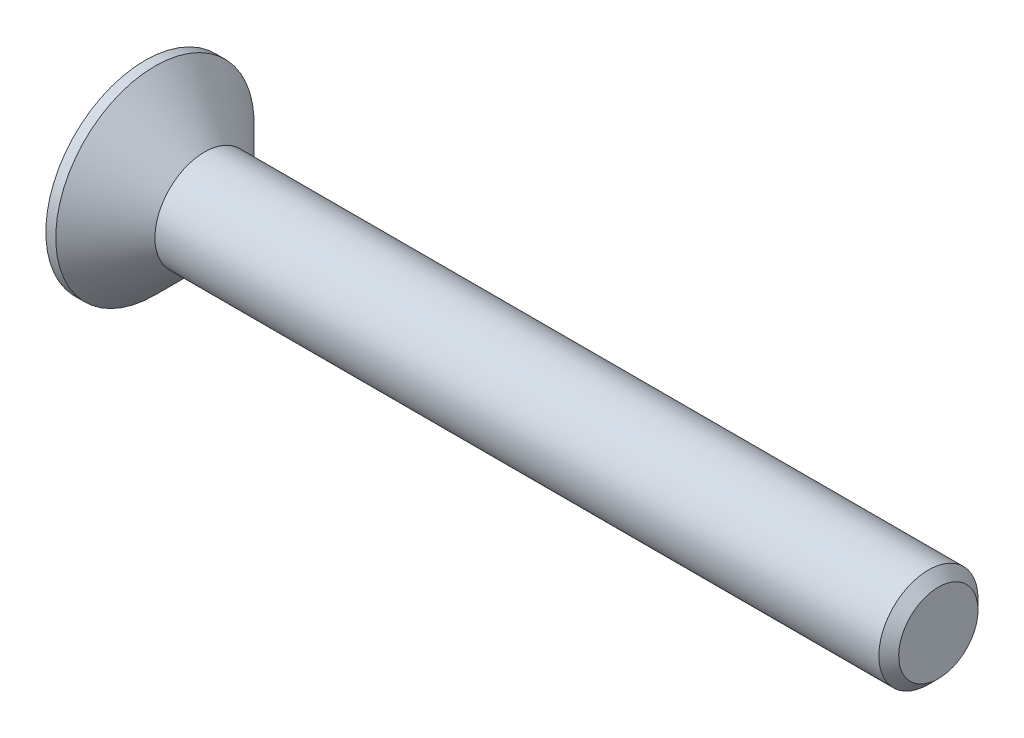
from build123d import *

# Parameters (mm, degrees)
CHAMFER1_SIZE      = 0.2
CUT_EXTRUDE1_DEPTH = 0.75


with BuildPart() as part:
    # Sketch1 → Revolve1 (revolve)
    with BuildSketch(Plane.XY, mode=Mode.PRIVATE) as revolve1_sk:
        Polygon((0, 1), (-1, 2), (-1.2, 2), (-1.2, 0), (14.8, 0), (14.8, 1), align=None)
    revolve(revolve1_sk.sketch.rotate(Axis((-1.2, 0, 0), (1, 0, 0)), 180), axis=Axis((-1.2, 0, 0), (1, 0, 0)))

    # Chamfer1
    chamfer1_edges = [part.edges().sort_by_distance(p)[0] for p in [
        (14.8, 1, 0),
    ]]
    chamfer(chamfer1_edges, length=CHAMFER1_SIZE)

    # Sketch2 → Cut-Extrude1 (cut)
    with BuildSketch(Plane.ZY.offset(1.2)):
        Polygon((-0.75055535, 0), (-0.375277675, -0.65), (0.375277675, -0.65), (0.75055535, 0), (0.375277675, 0.65), (-0.375277675, 0.65), align=None)
    extrude(amount=-CUT_EXTRUDE1_DEPTH, mode=Mode.SUBTRACT)


solid = part.part
